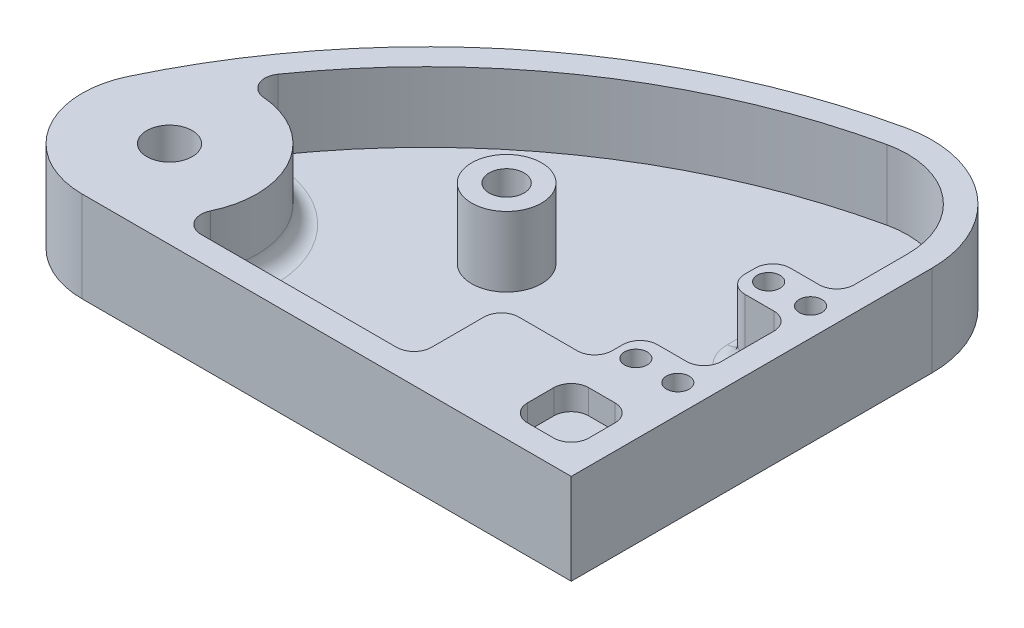
from build123d import *

# Parameters (mm, degrees)
BOSS_EXTRUDE1_DEPTH = 26
CUT_EXTRUDE1_START  = -20
CUT_EXTRUDE1_DEPTH  = 20
SKETCH3_W           = 17.5
SKETCH3_H           = 17.5
CUT_EXTRUDE2_DEPTH  = 7
FILLET1_R           = 5
HOLE1_D             = 13
HOLE1_DEPTH         = 30
HOLE2_D             = 6.5
HOLE2_DEPTH         = 30
SKETCH8_R           = 10
BOSS_EXTRUDE2_DEPTH = 20
HOLE3_D             = 10
HOLE3_DEPTH         = 30


with BuildPart() as part:
    # Sketch1 → Boss-Extrude1 (new body)
    with BuildSketch(Plane(origin=(0, 0, 0), x_dir=(1, 0, 0), z_dir=(0, 1, 0))):
        with BuildLine():
            Line((0, -25), (140, -25))
            Line((140, -25), (140, 78.289547156))
            ThreePointArc((140, 78.289547156), (128.151891006, 103.027720783), (101.450252951, 109.302865908))
            ThreePointArc((101.450252951, 109.302865908), (28.006457847, 74.395778776), (-22.580645161, 10.729140884))
            ThreePointArc((-22.580645161, 10.729140884), (-21.13325013, -13.356112419), (0, -25))
        make_face()
    extrude(amount=BOSS_EXTRUDE1_DEPTH)

    # Sketch2 → Cut-Extrude1 (cut)
    with BuildSketch(Plane(origin=(0, 26, 0), x_dir=(1, 0, 0), z_dir=(0, 1, 0)).offset(CUT_EXTRUDE1_START)):
        with BuildLine():
            Line((88, -18), (88, 7))
            Line((88, 7), (114.7, 7))
            Line((114.7, 7), (114.7, 20))
            Line((114.7, 20), (133, 20))
            Line((133, 20), (133, 45))
            Line((133, 45), (114.7, 45))
            Line((114.7, 45), (114.7, 58))
            Line((114.7, 58), (133, 58))
            Line((133, 58), (133, 78.289547156))
            ThreePointArc((133, 78.289547156), (123.764072516, 97.573635258), (102.949409781, 102.465283821))
            ThreePointArc((102.949409781, 102.465283821), (39.68753142, 74.427574639), (-7.525899138, 23.840319674))
            ThreePointArc((-7.525899138, 23.840319674), (21.489023757, 12.775831009), (17.349351573, -18))
            Line((17.349351573, -18), (88, -18))
        make_face()
    extrude(amount=CUT_EXTRUDE1_DEPTH, mode=Mode.SUBTRACT)

    # Sketch3 → Cut-Extrude2 (cut)
    with BuildSketch(Plane(origin=(0, 26, 0), x_dir=(1, 0, 0), z_dir=(0, 1, 0))):
        with Locations((124.25, -9.25)):
            Rectangle(SKETCH3_W, SKETCH3_H)
    extrude(amount=-CUT_EXTRUDE2_DEPTH, mode=Mode.SUBTRACT)

    # Fillet1
    fillet1_edges = [part.edges().sort_by_distance(p)[0] for p in [
        (123.85, 6, -58),
        (115.5, 22.5, 18),
        (115.5, 22.5, 0.5),
        (133, 22.5, 0.5),
        (133, 22.5, 18),
        (88, 16, 18),
        (133, 16, -45),
        (133, 16, -20),
        (114.7, 16, -20),
        (114.7, 16, -7),
        (88, 16, -7),
        (114.7, 16, -58),
        (133, 16, -58),
        (114.7, 16, -45),
        (-7.525899138, 16, -23.840319674),
        (17.349351573, 16, 18),
        (52.674675786, 6, 18),
        (88, 6, 5.5),
        (101.35, 6, -7),
        (114.7, 6, -13.5),
        (123.85, 6, -20),
        (133, 6, -32.5),
        (123.85, 6, -45),
        (114.7, 6, -51.5),
        (21.489023757, 6, -12.775831009),
    ]]
    fillet(fillet1_edges, radius=FILLET1_R)

    # Hole1
    with Locations(Plane(origin=(0, 26, 0), x_dir=(1, 0, 0), z_dir=(0, 1, 0))):
        with Locations((0, 0)):
            Hole(HOLE1_D / 2, depth=HOLE1_DEPTH)

    # Hole2
    with Locations(Plane(origin=(0, 26, 0), x_dir=(1, 0, 0), z_dir=(0, 1, 0))):
        with Locations((120, 51.5), (132, 51.5), (120, 13.5), (132, 13.5)):
            Hole(HOLE2_D / 2, depth=HOLE2_DEPTH)

    # Sketch8 → Boss-Extrude2 (add)
    with BuildSketch(Plane(origin=(0, 6, 0), x_dir=(1, 0, 0), z_dir=(0, 1, 0))):
        with Locations(Location((58, 38.5, 0), (0, 0, 270))):
            Circle(SKETCH8_R)
    extrude(amount=BOSS_EXTRUDE2_DEPTH)

    # Hole3
    with Locations(Plane(origin=(0, 26, 0), x_dir=(1, 0, 0), z_dir=(0, 1, 0))):
        with Locations((58, 38.5)):
            Hole(HOLE3_D / 2, depth=HOLE3_DEPTH)


solid = part.part
